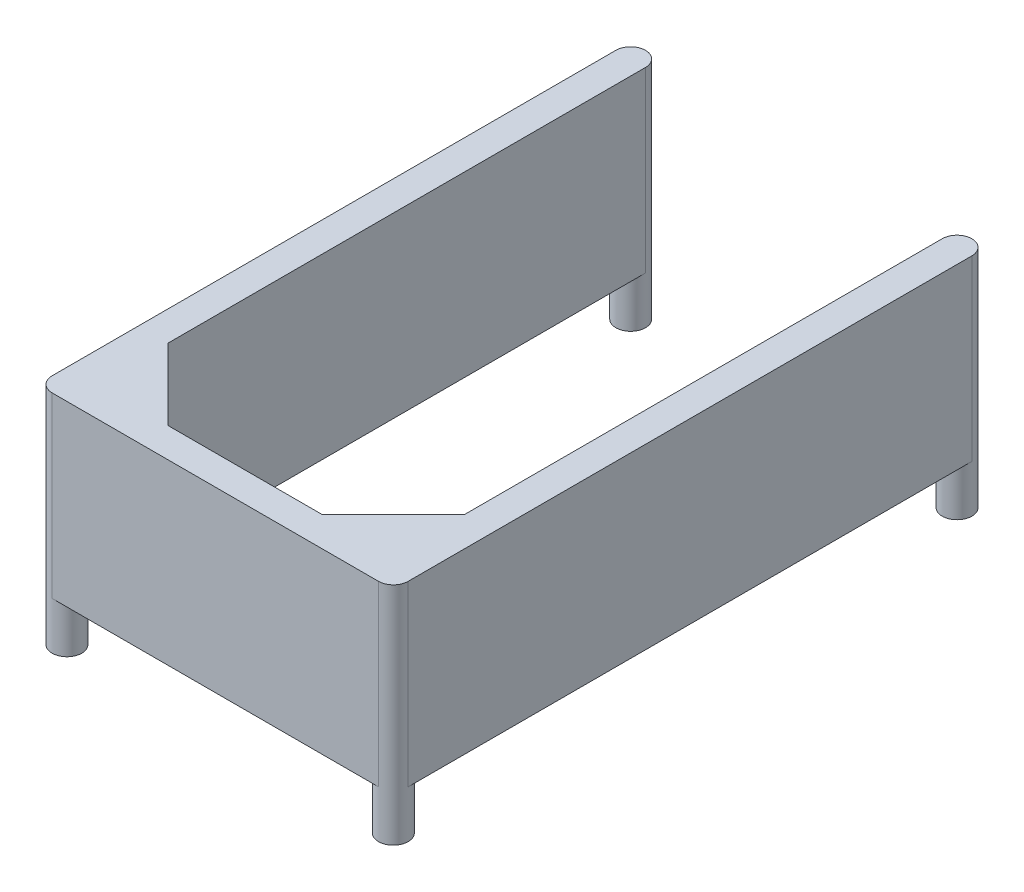
from build123d import *

# Parameters (mm, degrees)
BOSS_EXTRUDE1_DEPTH = 38.1
BOSS_EXTRUDE2_START = 10.16
SKETCH2_R           = 3.175
BOSS_EXTRUDE2_DEPTH = 10.16
CHAMFER1_SIZE       = 15.24


with BuildPart() as part:
    # Sketch1 → Boss-Extrude1 (new body)
    with BuildSketch(Plane(origin=(0, 0, 0), x_dir=(1, 0, 0), z_dir=(0, 1, 0))):
        with BuildLine():
            Line((-3.175, 0), (-3.175, 120.65))
            ThreePointArc((-3.175, 120.65), (0, 123.825), (3.175, 120.65))
            Line((3.175, 120.65), (3.175, 3.175))
            Line((3.175, 3.175), (66.675, 3.175))
            Line((66.675, 3.175), (66.675, 120.65))
            ThreePointArc((66.675, 120.65), (69.85, 123.825), (73.025, 120.65))
            Line((73.025, 120.65), (73.025, 0))
            ThreePointArc((73.025, 0), (72.09506403, -2.24506403), (69.85, -3.175))
            Line((69.85, -3.175), (0, -3.175))
            ThreePointArc((0, -3.175), (-2.24506403, -2.24506403), (-3.175, 0))
        make_face()
    extrude(amount=BOSS_EXTRUDE1_DEPTH)

    # Sketch2 → Boss-Extrude2 (add)
    with BuildSketch(Plane(origin=(0, 0, 0), x_dir=(-1, 0, 0), z_dir=(0, -1, 0)).offset(BOSS_EXTRUDE2_START)):
        with Locations(Location((-69.85, 120.65, 0), (0, 0, 90))):
            Circle(SKETCH2_R)
        with Locations(Location((0, 120.65, 0), (0, 0, 90))):
            Circle(SKETCH2_R)
        with Locations(Location((0, 0, 0), (0, 0, 90))):
            Circle(SKETCH2_R)
        with Locations(Location((-69.85, 0, 0), (0, 0, 90))):
            Circle(SKETCH2_R)
    extrude(amount=-BOSS_EXTRUDE2_DEPTH)

    # Chamfer1
    chamfer1_edges = [part.edges().sort_by_distance(p)[0] for p in [
        (3.175, 19.05, -3.175),
        (66.675, 19.05, -3.175),
    ]]
    chamfer(chamfer1_edges, length=CHAMFER1_SIZE)


solid = part.part
